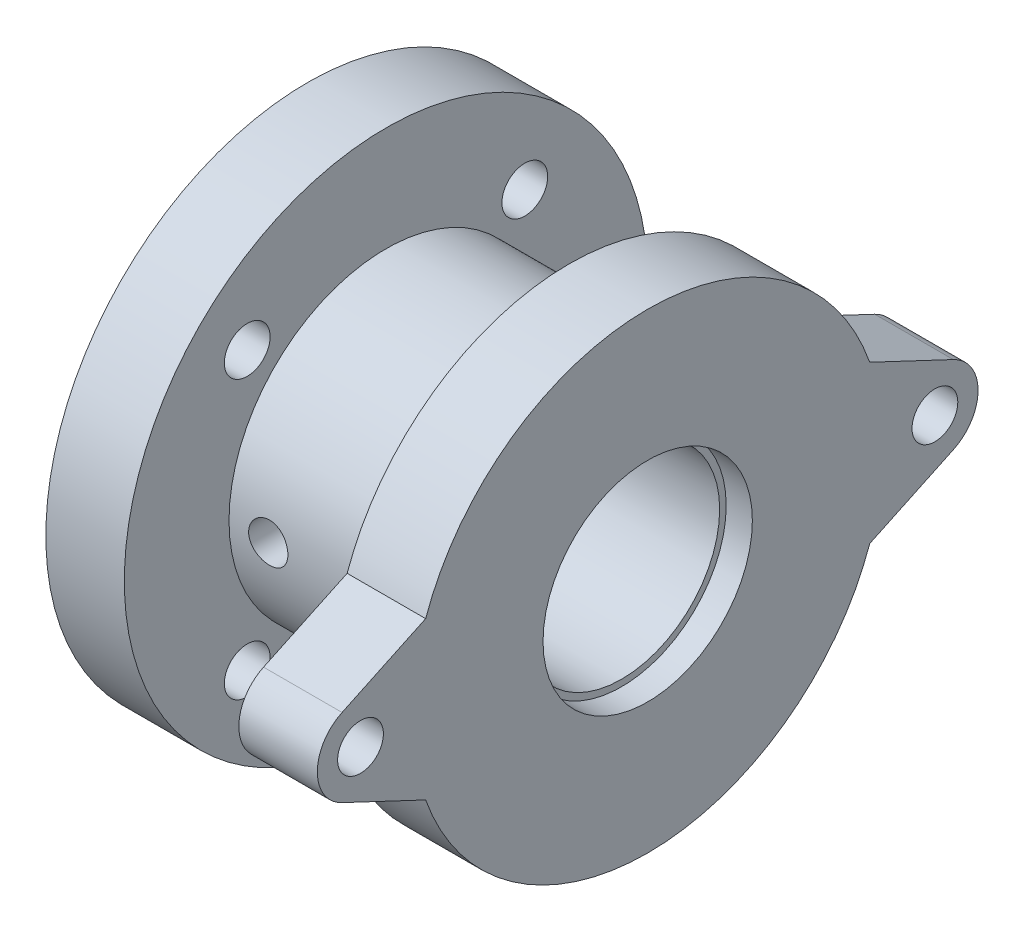
from build123d import *

# Parameters (mm, degrees)
SKETCH1_R               = 20
SKETCH1_R_2             = 7.5
BOSS_EXTRUDE1_DEPTH     = 6
SKETCH3_R               = 12
SKETCH3_R_2             = 7.5
BOSS_EXTRUDE2_DEPTH     = 14
CUT_EXTRUDE2_DEPTH      = 35.641016151
CUT_EXTRUDE2_DEPTH_BACK = 35.641016151
SKETCH4_R               = 1.5
SKETCH5_R               = 18
SKETCH5_R_2             = 7.5
BOSS_EXTRUDE3_DEPTH     = 6
BOSS_EXTRUDE4_START     = -6
SKETCH6_R               = 1.75
BOSS_EXTRUDE4_DEPTH     = 6
SKETCH2_R               = 1.75
CUT_EXTRUDE1_DEPTH      = 6
SKETCH7_R               = 8
CUT_EXTRUDE3_DEPTH      = 2


with BuildPart() as part:
    # Sketch1 → Boss-Extrude1 (new body)
    with BuildSketch(Plane(origin=(0, 0, 0), x_dir=(0, 0, -1), z_dir=(1, 0, 0))):
        Circle(SKETCH1_R)
        Circle(SKETCH1_R_2, mode=Mode.SUBTRACT)
    extrude(amount=BOSS_EXTRUDE1_DEPTH)

    # Sketch3 → Boss-Extrude2 (add)
    with BuildSketch(Plane(origin=(6, 0, 0), x_dir=(0, 0, -1), z_dir=(1, 0, 0))):
        Circle(SKETCH3_R)
        Circle(SKETCH3_R_2, mode=Mode.SUBTRACT)
    extrude(amount=BOSS_EXTRUDE2_DEPTH)

    # Sketch4 → Cut-Extrude2 (cut, two sides: drawn at the far end of the back side and taken through both)
    with BuildSketch(Plane.XY.offset(-CUT_EXTRUDE2_DEPTH_BACK)):
        with Locations((9, 0)):
            Circle(SKETCH4_R)
    extrude(amount=CUT_EXTRUDE2_DEPTH + CUT_EXTRUDE2_DEPTH_BACK, mode=Mode.SUBTRACT)

    # Sketch5 → Boss-Extrude3 (add)
    with BuildSketch(Plane(origin=(20, 0, 0), x_dir=(0, 0, -1), z_dir=(1, 0, 0))):
        Circle(SKETCH5_R)
        Circle(SKETCH5_R_2, mode=Mode.SUBTRACT)
    extrude(amount=BOSS_EXTRUDE3_DEPTH)

    # Sketch6 → Boss-Extrude4 (add)
    # profile 1 of 2: a face of its own
    with BuildSketch(Plane(origin=(26, 0, 0), x_dir=(0, 0, -1), z_dir=(1, 0, 0)).offset(BOSS_EXTRUDE4_START)):
        with BuildLine():
            Line((-23.358800107, 2.984171955), (-16.970562748, 6))
            ThreePointArc((-16.970562748, 6), (-18, 0), (-16.970562748, -6))
            Line((-16.970562748, -6), (-23.358800107, -2.984171955))
            ThreePointArc((-23.358800107, -2.984171955), (-25.25, 0), (-23.358800107, 2.984171955))
        make_face()
        with Locations((-21.95, 0)):
            Circle(SKETCH6_R, mode=Mode.SUBTRACT)
    # profile 2 of 2: a face of its own
    with BuildSketch(Plane(origin=(26, 0, 0), x_dir=(0, 0, -1), z_dir=(1, 0, 0)).offset(BOSS_EXTRUDE4_START)):
        with BuildLine():
            Line((23.358800107, 2.984171955), (16.970562748, 6))
            ThreePointArc((16.970562748, 6), (18, 0), (16.970562748, -6))
            Line((16.970562748, -6), (23.358800107, -2.984171955))
            ThreePointArc((23.358800107, -2.984171955), (25.25, 0), (23.358800107, 2.984171955))
        make_face()
        with Locations((21.95, 0)):
            Circle(SKETCH6_R, mode=Mode.SUBTRACT)
    extrude(amount=BOSS_EXTRUDE4_DEPTH)

    # Sketch2 → Cut-Extrude1 (cut)
    with BuildSketch(Plane.ZY):
        with Locations((-10.606601718, 10.606601718)):
            Circle(SKETCH2_R)
        with Locations((10.606601718, 10.606601718)):
            Circle(SKETCH2_R)
        with Locations((10.606601718, -10.606601718)):
            Circle(SKETCH2_R)
        with Locations((-10.606601718, -10.606601718)):
            Circle(SKETCH2_R)
    extrude(amount=-CUT_EXTRUDE1_DEPTH, mode=Mode.SUBTRACT)

    # Sketch7 → Cut-Extrude3 (cut)
    with BuildSketch(Plane(origin=(26, 0, 0), x_dir=(0, 0, -1), z_dir=(1, 0, 0))):
        Circle(SKETCH7_R)
    extrude(amount=-CUT_EXTRUDE3_DEPTH, mode=Mode.SUBTRACT)


solid = part.part
